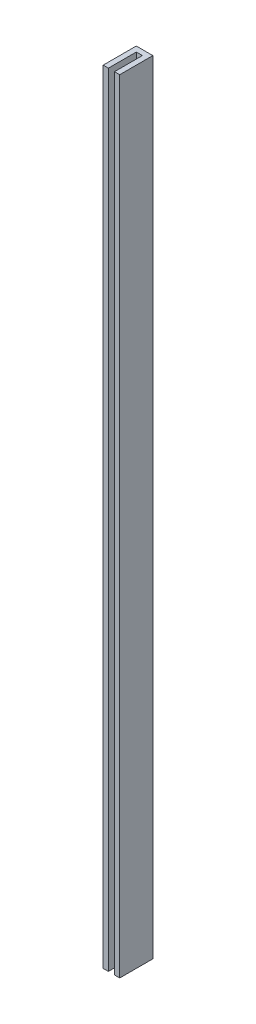
from build123d import *

# Parameters (mm, degrees)
RESSALTO_EXTRUS_O1_DEPTH = 300


with BuildPart() as part:
    # Esboço1 → Ressalto-extrusão1 (new body)
    with BuildSketch(Plane(origin=(0, 0, 0), x_dir=(1, 0, 0), z_dir=(0, 1, 0))):
        Polygon((3.175, 0), (-3.175, 0), (-3.175, -12.7), (-1.175, -12.7), (-1.175, -2), (1.175, -2), (1.175, -12.7), (3.175, -12.7), align=None)
    extrude(amount=RESSALTO_EXTRUS_O1_DEPTH)


solid = part.part
